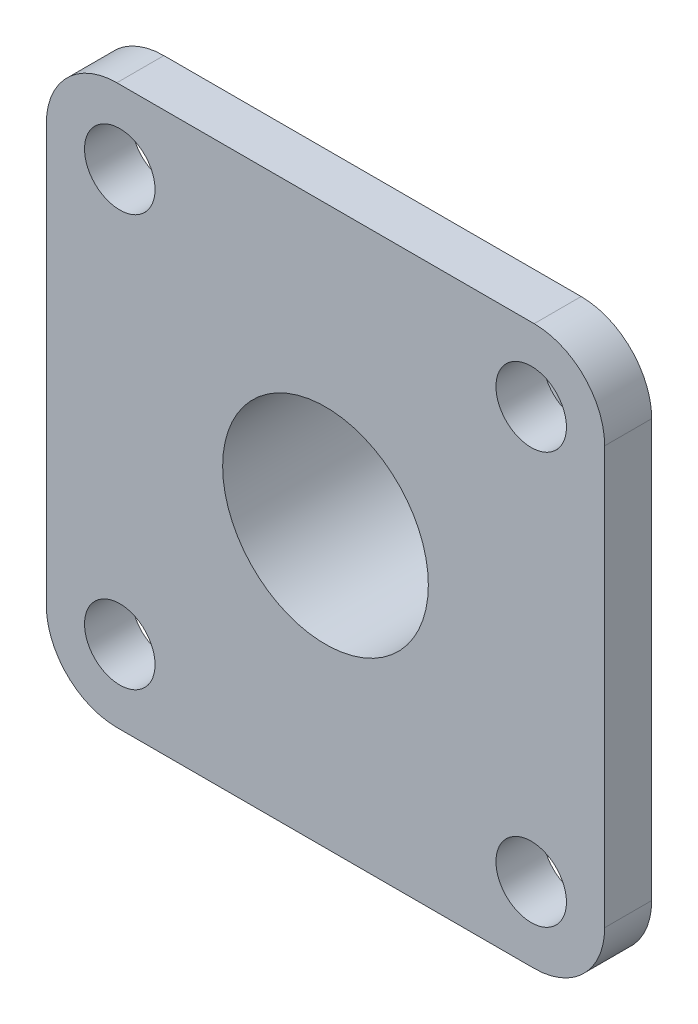
from build123d import *
from build123d.topology import SkipClean

# Parameters (mm, degrees)
SKETCH1_R           = 6
SKETCH1_R_2         = 17.5
BOSS_EXTRUDE1_DEPTH = 8
BOSS_EXTRUDE2_START = 20
SKETCH2_R           = 27.5
SKETCH2_R_2         = 17.5
BOSS_EXTRUDE2_DEPTH = 20


with BuildPart() as part:
    # Sketch1 → Boss-Extrude1 (new body)
    with BuildSketch(Plane(origin=(0, 0, 0), x_dir=(-1, 0, 0), z_dir=(0, 0, 1))):
        with BuildLine():
            Line((-35.5, 47.5), (35.5, 47.5))
            ThreePointArc((35.5, 47.5), (43.985281374, 43.985281374), (47.5, 35.5))
            Line((47.5, 35.5), (47.5, -35.5))
            ThreePointArc((47.5, -35.5), (43.985281374, -43.985281374), (35.5, -47.5))
            Line((35.5, -47.5), (-35.5, -47.5))
            ThreePointArc((-35.5, -47.5), (-43.985281374, -43.985281374), (-47.5, -35.5))
            Line((-47.5, -35.5), (-47.5, 35.5))
            ThreePointArc((-47.5, 35.5), (-43.985281374, 43.985281374), (-35.5, 47.5))
        make_face()
        with Locations(Location((35, 35, 0), (0, 0, 180))):
            Circle(SKETCH1_R, mode=Mode.SUBTRACT)
        with Locations(Location((-35, 35, 0), (0, 0, 180))):
            Circle(SKETCH1_R, mode=Mode.SUBTRACT)
        with Locations(Location((35, -35, 0), (0, 0, 180))):
            Circle(SKETCH1_R, mode=Mode.SUBTRACT)
        with Locations(Location((-35, -35, 0), (0, 0, 180))):
            Circle(SKETCH1_R, mode=Mode.SUBTRACT)
        with Locations(Location((0, 0, 0), (0, 0, 180))):
            Circle(SKETCH1_R_2, mode=Mode.SUBTRACT)
    extrude(amount=BOSS_EXTRUDE1_DEPTH)

    # Sketch2 → Boss-Extrude2 (add)
    with SkipClean():  # the faces are left unmerged after this step: merging them gives an invalid solid
        with BuildSketch(Plane(origin=(0, 0, 0), x_dir=(-1, 0, 0), z_dir=(0, 0, -1)).offset(BOSS_EXTRUDE2_START)):
            with Locations(Location((0, 0, 0), (0, 0, 180))):
                Circle(SKETCH2_R)
            Circle(SKETCH2_R_2, mode=Mode.SUBTRACT)
        extrude(amount=-BOSS_EXTRUDE2_DEPTH)


solid = part.part
